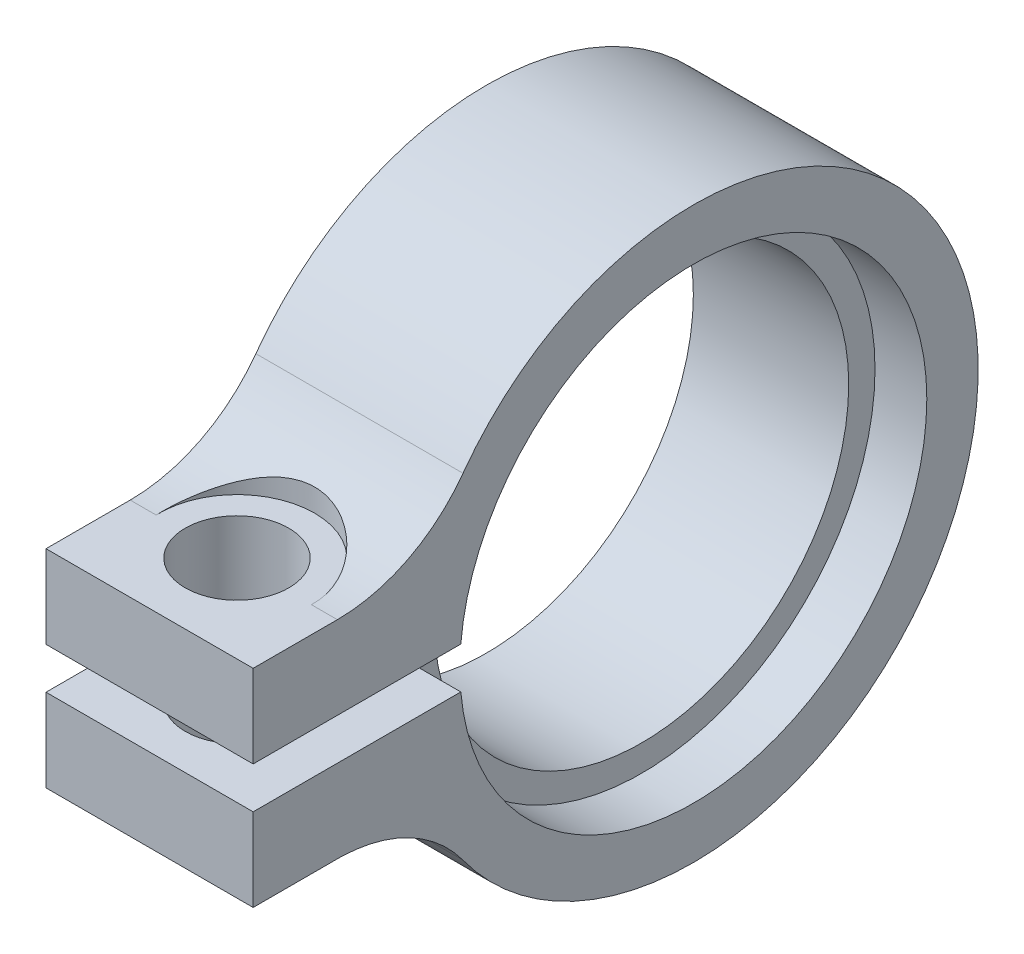
from build123d import *

# Parameters (mm, degrees)
BOSS_EXTRUDE1_DEPTH = 9.525
BOSS_EXTRUDE2_START = -3.175
BOSS_EXTRUDE2_DEPTH = 3.175
FILLET1_R           = 9.525
SKETCH2_R           = 4.7625
SKETCH2_R_2         = 3.175
CUT_EXTRUDE1_DEPTH  = 71.245753875
SKETCH2_4_R         = 3.175
CUT_EXTRUDE2_DEPTH  = 71.245753961
CUT_EXTRUDE4_START  = -12.7
SKETCH2_6_R         = 4.7625
SKETCH2_6_R_2       = 3.175
CUT_EXTRUDE4_DEPTH  = 58.545753961


with BuildPart() as part:
    # Sketch1 → Boss-Extrude1 (new body)
    with BuildSketch(Plane.ZY.offset(50.8)):
        with BuildLine():
            ThreePointArc((12.636340451, 186.18), (-12.7, 187.45), (12.636340451, 188.72))
            Line((12.636340451, 188.72), (26.9875, 188.72))
            Line((26.9875, 188.72), (26.9875, 193.8))
            Line((26.9875, 193.8), (16.267034341, 193.8))
            ThreePointArc((16.267034341, 193.8), (-17.4625, 187.45), (16.267034341, 181.1))
            Line((16.267034341, 181.1), (26.9875, 181.1))
            Line((26.9875, 181.1), (26.9875, 186.18))
            Line((26.9875, 186.18), (12.636340451, 186.18))
        make_face()
    extrude(amount=BOSS_EXTRUDE1_DEPTH)

    # Sketch1<4> → Boss-Extrude2 (add)
    with BuildSketch(Plane.ZY.offset(50.8).offset(BOSS_EXTRUDE2_START)):
        with BuildLine():
            Line((17.416256953, 186.18), (14.256444382, 186.18))
            ThreePointArc((14.256444382, 186.18), (-14.3129, 187.45), (14.256444382, 188.72))
            Line((14.256444382, 188.72), (17.416256953, 188.72))
            ThreePointArc((17.416256953, 188.72), (17.032105803, 191.303086834), (16.267034341, 193.8))
            ThreePointArc((16.267034341, 193.8), (-17.4625, 187.45), (16.267034341, 181.1))
            ThreePointArc((16.267034341, 181.1), (17.032105803, 183.596913166), (17.416256953, 186.18))
        make_face()
        with BuildLine():
            ThreePointArc((16.267034341, 193.8), (17.032105803, 191.303086834), (17.416256953, 188.72))
            Line((17.416256953, 188.72), (26.9875, 188.72))
            Line((26.9875, 188.72), (26.9875, 193.8))
            Line((26.9875, 193.8), (16.267034341, 193.8))
        make_face()
        with BuildLine():
            Line((26.9875, 186.18), (17.416256953, 186.18))
            ThreePointArc((17.416256953, 186.18), (17.032105803, 183.596913166), (16.267034341, 181.1))
            Line((16.267034341, 181.1), (26.9875, 181.1))
            Line((26.9875, 181.1), (26.9875, 186.18))
        make_face()
    extrude(amount=BOSS_EXTRUDE2_DEPTH)

    # Fillet1
    fillet1_edges = [part.edges().sort_by_distance(p)[0] for p in [
        (-53.975, 181.1, 16.267034341),
        (-53.975, 193.8, 16.267034341),
    ]]
    fillet(fillet1_edges, radius=FILLET1_R)

    # Sketch2 → Cut-Extrude1 (cut, through all)
    # profile 1 of 2: a face of its own
    with BuildSketch(Plane(origin=(0, 193.8, 0), x_dir=(1, 0, 0), z_dir=(0, 1, 0))):
        with Locations((-53.975, -21.62726717)):
            Circle(SKETCH2_R)
        with Locations((-53.975, -21.62726717)):
            Circle(SKETCH2_R_2, mode=Mode.SUBTRACT)
    # profile 2 of 2: a face of its own
    with BuildSketch(Plane(origin=(0, 193.8, 0), x_dir=(1, 0, 0), z_dir=(0, 1, 0))):
        with Locations((-53.975, -21.62726717)):
            Circle(SKETCH2_R_2)
    extrude(amount=CUT_EXTRUDE1_DEPTH, mode=Mode.SUBTRACT)

    # Sketch2<4> → Cut-Extrude2 (cut, through all)
    with BuildSketch(Plane(origin=(0, 193.8, 0), x_dir=(1, 0, 0), z_dir=(0, 1, 0))):
        with Locations(Location((-53.975, -21.62726717, 0), (0, 0, 270))):
            Circle(SKETCH2_4_R)
    extrude(amount=-CUT_EXTRUDE2_DEPTH, mode=Mode.SUBTRACT)

    # Sketch2<6> → Cut-Extrude4 (cut, through all)
    # profile 1 of 3: a face of its own
    with BuildSketch(Plane(origin=(0, 193.8, 0), x_dir=(1, 0, 0), z_dir=(0, 1, 0)).offset(CUT_EXTRUDE4_START)):
        Polygon((-60.325, -21.513289799), (-60.325, -21.741244542), (-57.296072999, -26.9875), (-50.653927001, -26.9875), (-47.625, -21.741244542), (-47.625, -21.513289799), (-50.653927001, -16.267034341), (-57.296072999, -16.267034341), align=None)
        with Locations((-53.975, -21.62726717)):
            Circle(SKETCH2_6_R, mode=Mode.SUBTRACT)
    # profile 2 of 3: a face of its own
    with BuildSketch(Plane(origin=(0, 193.8, 0), x_dir=(1, 0, 0), z_dir=(0, 1, 0)).offset(CUT_EXTRUDE4_START)):
        with Locations((-53.975, -21.62726717)):
            Circle(SKETCH2_6_R)
        with Locations(Location((-53.975, -21.62726717, 0), (0, 0, 270))):
            Circle(SKETCH2_6_R_2, mode=Mode.SUBTRACT)
    # profile 3 of 3: a face of its own
    with BuildSketch(Plane(origin=(0, 193.8, 0), x_dir=(1, 0, 0), z_dir=(0, 1, 0)).offset(CUT_EXTRUDE4_START)):
        with Locations(Location((-53.975, -21.62726717, 0), (0, 0, 270))):
            Circle(SKETCH2_6_R_2)
    extrude(amount=-CUT_EXTRUDE4_DEPTH, mode=Mode.SUBTRACT)


solid = part.part
